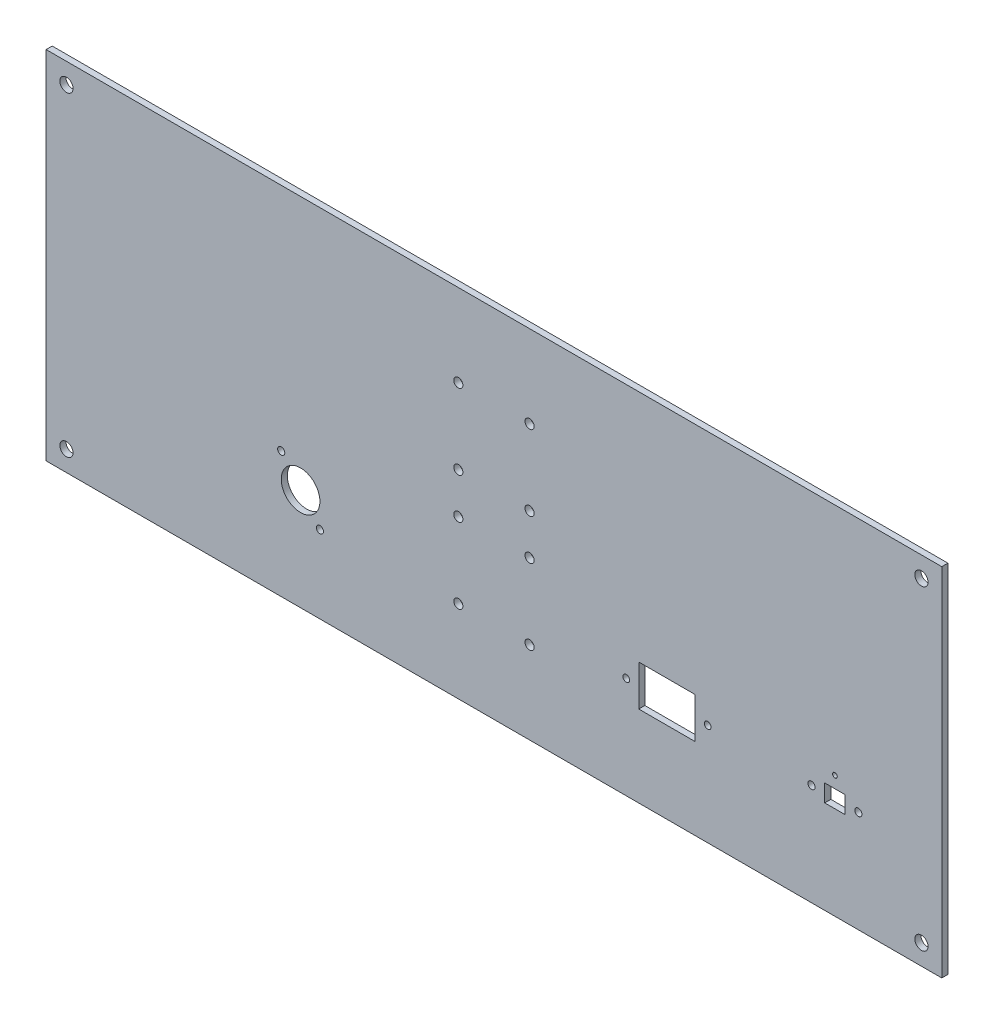
from build123d import *

# Parameters (mm, degrees)
SKETCH1_W           = 440
SKETCH1_H           = 175
SKETCH1_R           = 9.5
SKETCH1_R_2         = 1.75
SKETCH1_R_3         = 1.65
SKETCH1_R_4         = 1.15
SKETCH1_R_5         = 3.25
SKETCH1_R_6         = 2.25
SKETCH1_W_2         = 27.7
SKETCH1_H_2         = 20
SKETCH1_W_3         = 10
SKETCH1_H_3         = 8.5
BOSS_EXTRUDE1_DEPTH = 3


with BuildPart() as part:
    # Sketch1 → Boss-Extrude1 (new body)
    with BuildSketch(Plane.XY):
        with Locations((220, 87.5)):
            Rectangle(SKETCH1_W, SKETCH1_H)
        with Locations((125, 50)):
            Circle(SKETCH1_R, mode=Mode.SUBTRACT)
        with Locations((115.5, 62)):
            Circle(SKETCH1_R_2, mode=Mode.SUBTRACT)
        with Locations((134.5, 38)):
            Circle(SKETCH1_R_2, mode=Mode.SUBTRACT)
        with Locations((285, 50)):
            Circle(SKETCH1_R_3, mode=Mode.SUBTRACT)
        with Locations((325, 50)):
            Circle(SKETCH1_R_3, mode=Mode.SUBTRACT)
        with Locations((387.5, 60)):
            Circle(SKETCH1_R_4, mode=Mode.SUBTRACT)
        with Locations((376, 50)):
            Circle(SKETCH1_R_2, mode=Mode.SUBTRACT)
        with Locations((399, 50)):
            Circle(SKETCH1_R_2, mode=Mode.SUBTRACT)
        with Locations((10, 165)):
            Circle(SKETCH1_R_5, mode=Mode.SUBTRACT)
        with Locations((10, 10)):
            Circle(SKETCH1_R_5, mode=Mode.SUBTRACT)
        with Locations((430, 10)):
            Circle(SKETCH1_R_5, mode=Mode.SUBTRACT)
        with Locations((430, 165)):
            Circle(SKETCH1_R_5, mode=Mode.SUBTRACT)
        with Locations((202.5, 134.5)):
            Circle(SKETCH1_R_6, mode=Mode.SUBTRACT)
        with Locations((202.5, 97.5)):
            Circle(SKETCH1_R_6, mode=Mode.SUBTRACT)
        with Locations((237.5, 134.5)):
            Circle(SKETCH1_R_6, mode=Mode.SUBTRACT)
        with Locations((237.5, 97.5)):
            Circle(SKETCH1_R_6, mode=Mode.SUBTRACT)
        with Locations((237.5, 77.5)):
            Circle(SKETCH1_R_6, mode=Mode.SUBTRACT)
        with Locations((237.5, 40.5)):
            Circle(SKETCH1_R_6, mode=Mode.SUBTRACT)
        with Locations((202.5, 77.5)):
            Circle(SKETCH1_R_6, mode=Mode.SUBTRACT)
        with Locations((202.5, 40.5)):
            Circle(SKETCH1_R_6, mode=Mode.SUBTRACT)
        with Locations((305, 50)):
            Rectangle(SKETCH1_W_2, SKETCH1_H_2, mode=Mode.SUBTRACT)
        with Locations((387.5, 50)):
            Rectangle(SKETCH1_W_3, SKETCH1_H_3, mode=Mode.SUBTRACT)
    extrude(amount=BOSS_EXTRUDE1_DEPTH)


solid = part.part
